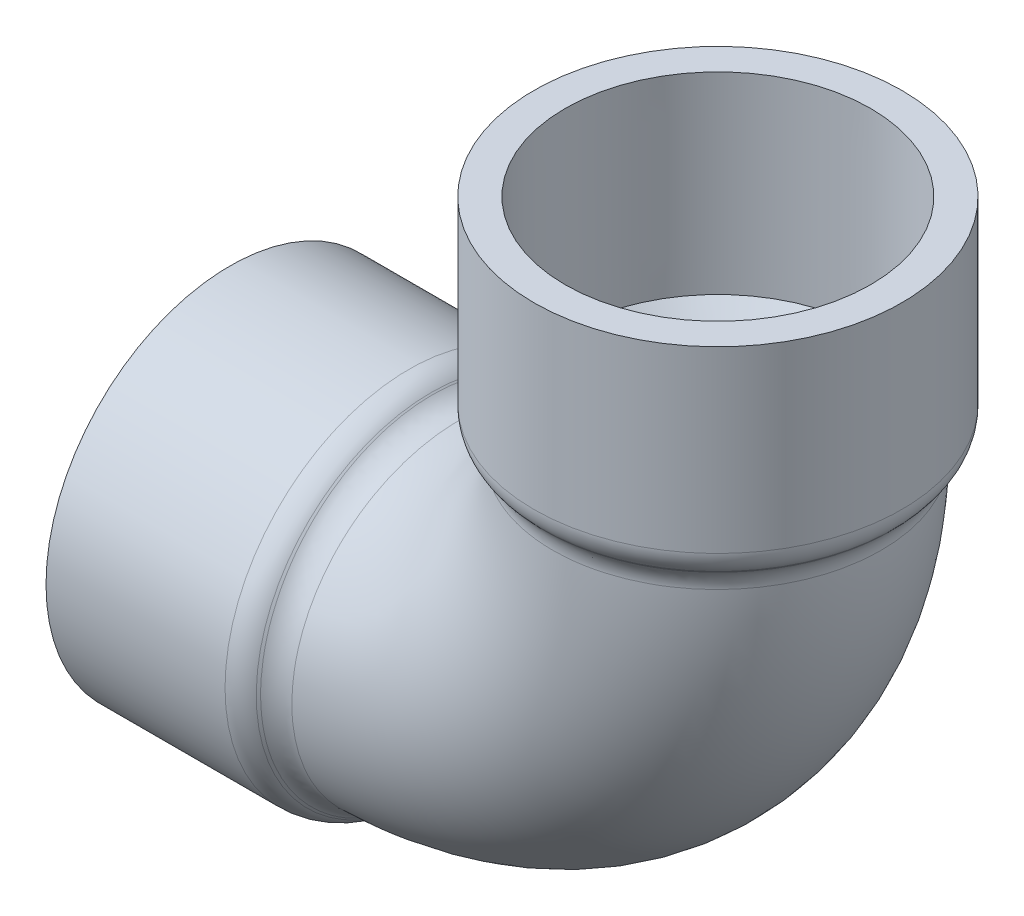
from build123d import *

# Parameters (mm, degrees)
SKETCH3_R   = 32.4485
SKETCH3_R_2 = 26.2509
FILLET1_R   = 6.1976


with BuildPart() as part:
    # Sketch1 → Revolve1 (revolve)
    with BuildSketch(Plane.XY, mode=Mode.PRIVATE) as revolve1_sk:
        Polygon((-58.7375, -36.5125), (-54.6735, -32.4485), (-54.6735, -26.2509), (-58.7375, -30.0863), (-96.8375, -30.3149), (-96.8375, -36.5125), align=None)
    revolve(revolve1_sk.sketch.rotate(Axis((-96.8375, 0, 0), (1, 0, 0)), 270), axis=Axis((-96.8375, 0, 0), (1, 0, 0)))



with BuildPart() as body_2:
    # Sketch2 → Revolve2 (revolve)
    with BuildSketch(Plane.XY, mode=Mode.PRIVATE) as revolve2_sk:
        Polygon((30.3149, 96.8375), (30.0863, 58.7375), (26.2509, 54.6735), (32.4485, 54.6735), (36.5125, 58.7375), (36.5125, 96.8375), align=None)
    revolve(revolve2_sk.sketch.rotate(Axis((0, 0, 0), (0, 1, 0)), 90), axis=Axis((0, 0, 0), (0, 1, 0)))


with BuildPart() as part_1:
    add(part.part)

    add(body_2.part)  # Sweep1 merges body 2
    # Sweep1: sweep along a path in Sketch4
    with BuildLine(Plane.XY) as sweep1_path:
        ThreePointArc((-54.6735, 0), (-16.013497399, 16.013497399), (0, 54.6735))
    # Sketch3 → Sweep1 (sweep)
    with BuildSketch(Plane(origin=(-54.6735, 0, 0), x_dir=(0, 0, -1), z_dir=(1, 0, 0))):
        Circle(SKETCH3_R)
        Circle(SKETCH3_R_2, mode=Mode.SUBTRACT)
    sweep(path=sweep1_path.line)

    # Fillet1
    fillet1_edges = [part_1.edges().sort_by_distance(p)[0] for p in [
        (-54.6735, -32.4485, 0),
        (0, 54.6735, 32.4485),
        (0, 58.7375, 36.5125),
        (-58.7375, 0, -36.5125),
    ]]
    fillet(fillet1_edges, radius=FILLET1_R)


solid = part_1.part
